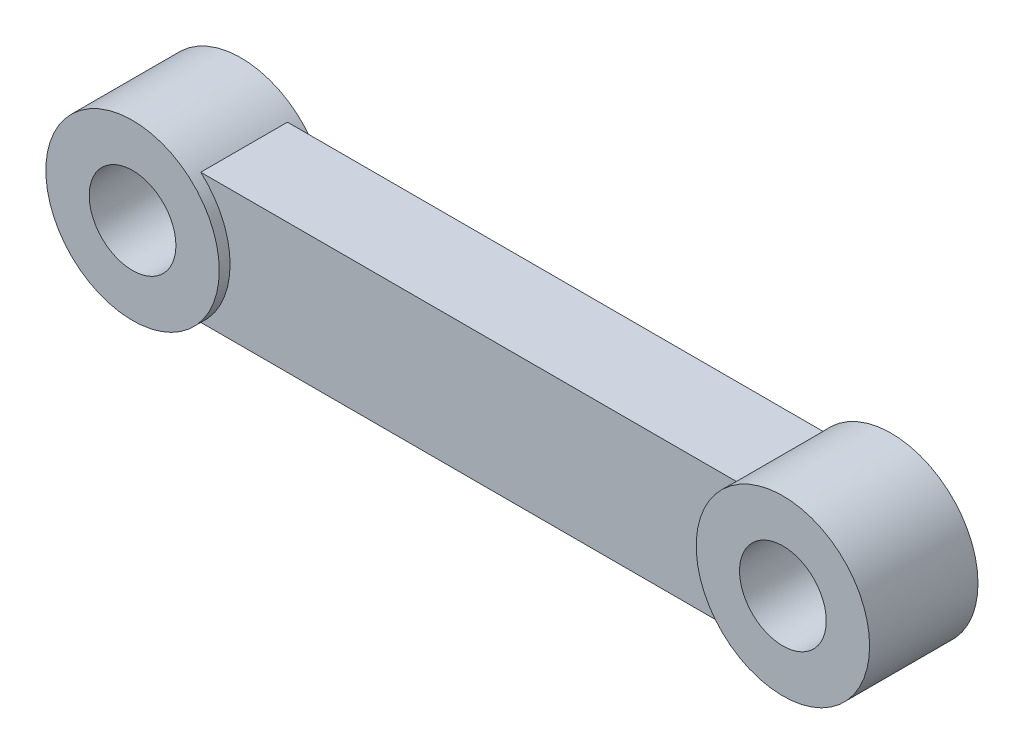
from build123d import *

# Parameters (mm, degrees)
SKETCH_1_R        = 8
SKETCH_1_R_2      = 4
EXTRUDE_1_DEPTH   = 10
EXTRUDE_1_2_DEPTH = 10
SKETCH_2_W        = 49.416994756
SKETCH_2_H        = 12
EXTRUDE_2_DEPTH   = 4


with BuildPart() as part:
    # 草图1 → 凸台-拉伸1 (new body)
    with BuildSketch(Plane.XY):
        Circle(SKETCH_1_R)
        Circle(SKETCH_1_R_2, mode=Mode.SUBTRACT)
    extrude(amount=EXTRUDE_1_DEPTH)



with BuildPart() as body_2:
    # 草图1 → Extrude 1 2 (new body)
    with BuildSketch(Plane.XY):
        with Locations((60, 0)):
            Circle(SKETCH_1_R)
        with Locations((60, 0)):
            Circle(SKETCH_1_R_2, mode=Mode.SUBTRACT)
    extrude(amount=EXTRUDE_1_2_DEPTH)


with BuildPart() as part_1:
    add(part.part)

    add(body_2.part)  # 凸台-拉伸2 merges body 2
    # 草图2 → 凸台-拉伸2 (add, symmetric)
    with BuildSketch(Plane.XY.offset(5)):
        with Locations((30, 0)):
            Rectangle(SKETCH_2_W, SKETCH_2_H)
    extrude(amount=EXTRUDE_2_DEPTH, both=True)


solid = part_1.part
